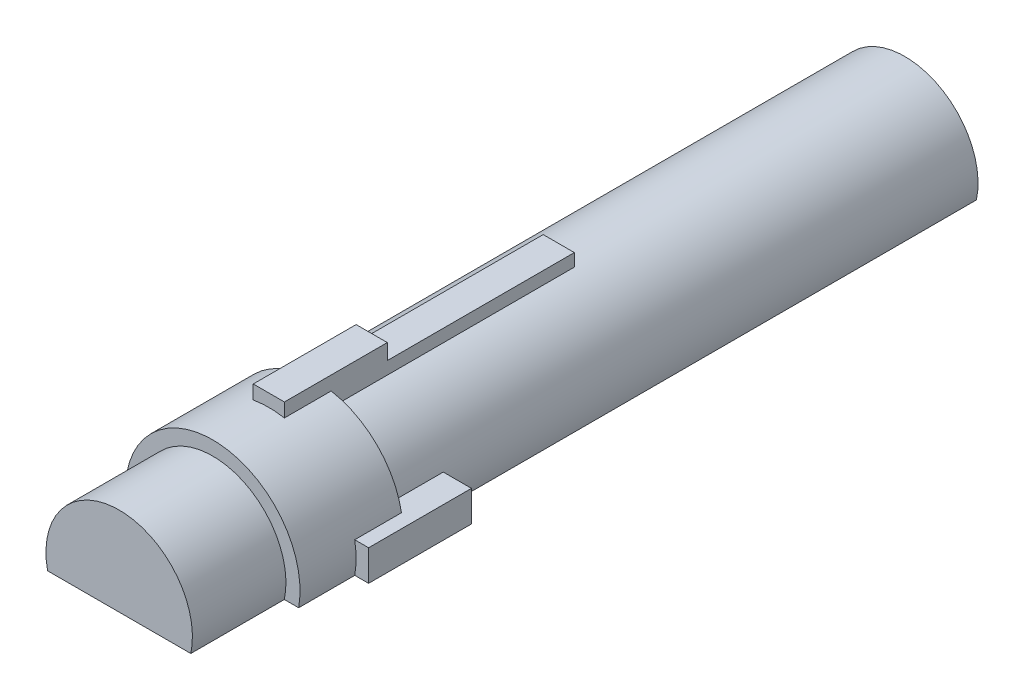
from build123d import *

# Parameters (mm, degrees)
BOSS_EXTRUDE1_DEPTH      = 42
BOSS_EXTRUDE2_START      = -5
BOSS_EXTRUDE2_DEPTH      = 5.5
BOSS_EXTRUDE4_DEPTH      = 2.5
BOSS_EXTRUDE4_DEPTH_BACK = 3
SKETCH6_W                = 1.666666666
SKETCH6_H                = 4.236096709
BOSS_EXTRUDE5_DEPTH      = 10


with BuildPart() as part:
    # Sketch1 → Boss-Extrude1 (new body)
    with BuildSketch(Plane.XY):
        with BuildLine():
            Line((3.829096611, -0.815625), (-3.829096611, -0.815625))
            ThreePointArc((-3.829096611, -0.815625), (0, 3.915), (3.829096611, -0.815625))
        make_face()
    extrude(amount=BOSS_EXTRUDE1_DEPTH)

    # Sketch2 → Boss-Extrude2 (add)
    with BuildSketch(Plane.XY.offset(42).offset(BOSS_EXTRUDE2_START)):
        with BuildLine():
            Line((4.594837716, -0.815625), (-4.594837716, -0.815625))
            ThreePointArc((-4.594837716, -0.815625), (-4.648674746, -0.40939087), (-4.666666667, 0))
            ThreePointArc((-4.666666667, 0), (0, 4.666666667), (4.666666667, 0))
            ThreePointArc((4.666666667, 0), (4.648674746, -0.40939087), (4.594837716, -0.815625))
        make_face()
    extrude(amount=-BOSS_EXTRUDE2_DEPTH)

    # Sketch5 → Boss-Extrude4 (add, two sides: drawn at the far end of the back side and taken through both)
    with BuildSketch(Plane.XY.offset(31.5).offset(-BOSS_EXTRUDE4_DEPTH_BACK)):
        with BuildLine():
            Line((5.333333333, 0.833333333), (3.825281762, 0.833333333))
            ThreePointArc((3.825281762, 0.833333333), (2.768323048, 2.768323048), (0.833333333, 3.825281762))
            Line((0.833333333, 3.825281762), (0.833333333, 5.333333333))
            Line((0.833333333, 5.333333333), (-0.833333333, 5.333333333))
            Line((-0.833333333, 5.333333333), (-0.833333333, 3.825281762))
            ThreePointArc((-0.833333333, 3.825281762), (-2.768323048, 2.768323048), (-3.825281762, 0.833333333))
            Line((-3.825281762, 0.833333333), (-5.333333333, 0.833333333))
            Line((-5.333333333, 0.833333333), (-5.333333333, -0.815625))
            Line((-5.333333333, -0.815625), (5.333333333, -0.815625))
            Line((5.333333333, -0.815625), (5.333333333, 0.833333333))
        make_face()
    extrude(amount=BOSS_EXTRUDE4_DEPTH + BOSS_EXTRUDE4_DEPTH_BACK)

    # Sketch6 → Boss-Extrude5 (add)
    with BuildSketch(Plane(origin=(0, 0, 28.5), x_dir=(-1, 0, 0), z_dir=(0, 0, -1))):
        with Locations((0, 2.381951646)):
            Rectangle(SKETCH6_W, SKETCH6_H)
    extrude(amount=BOSS_EXTRUDE5_DEPTH)


solid = part.part
